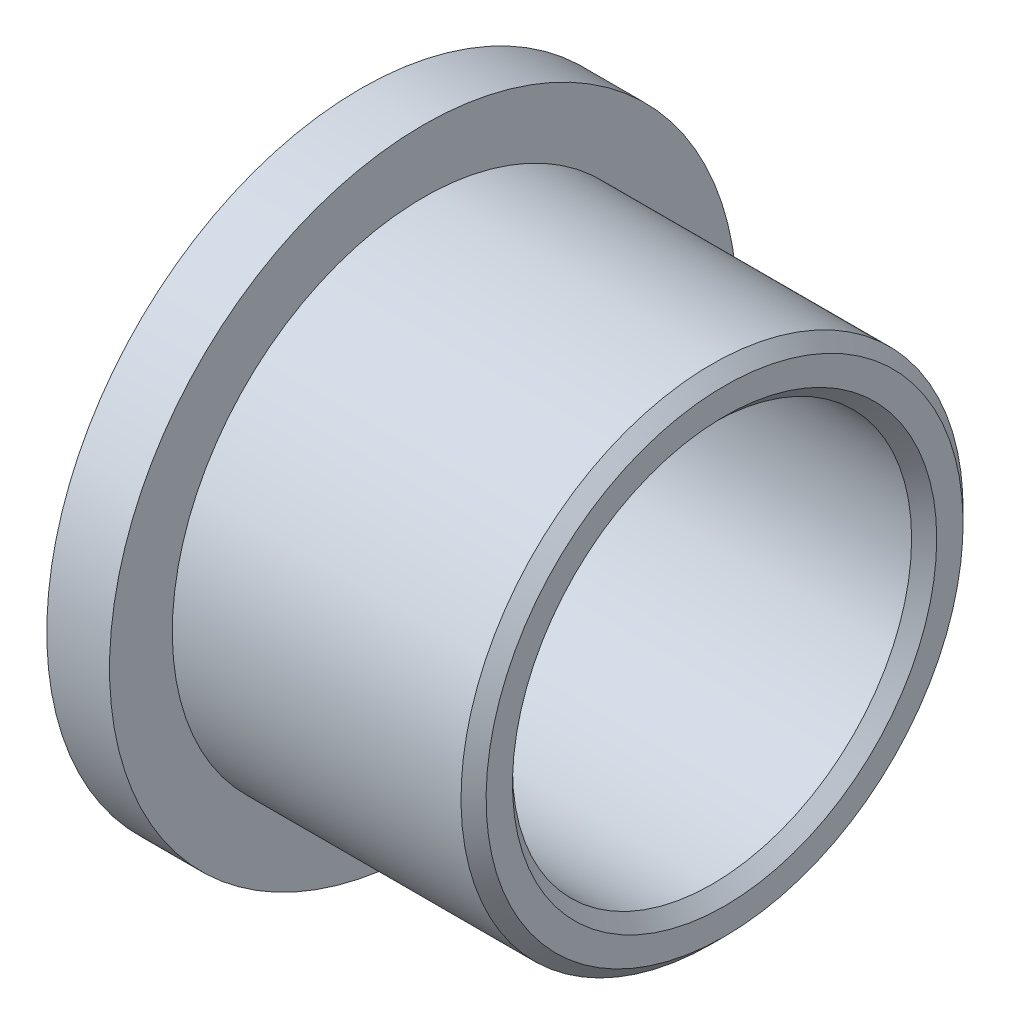
from build123d import *

# Parameters (mm, degrees)
DIAM_TRE_DU_PER_AGE_0_15_0_15_1_D = 15.9
CHANFREIN1_SIZE                   = 0.5


with BuildPart() as part:
    # Esquisse1 → Révolution1 (revolve)
    with BuildSketch(Plane.XY, mode=Mode.PRIVATE) as r_volution1_sk:
        Polygon((0, 0), (0, 12.5), (2.5, 12.5), (2.5, 10), (14.5, 10), (14.5, 0), align=None)
    revolve(r_volution1_sk.sketch.rotate(Axis((-19.53975326, 0, 0), (1, 0, 0)), 180), axis=Axis((-19.53975326, 0, 0), (1, 0, 0)))

    # Diamètre du perçage Ø0.15 (0.15)1 (through all)
    with Locations(Plane(origin=(14.5, 0, 0), x_dir=(0, 0, -1), z_dir=(1, 0, 0))):
        with Locations((0, 0)):
            Hole(DIAM_TRE_DU_PER_AGE_0_15_0_15_1_D / 2)

    # Chanfrein1
    chanfrein1_edges = [part.edges().sort_by_distance(p)[0] for p in [
        (14.5, 0, -7.95),
        (0, 0, -7.95),
        (14.5, 10, 0),
    ]]
    chamfer(chanfrein1_edges, length=CHANFREIN1_SIZE)


solid = part.part
